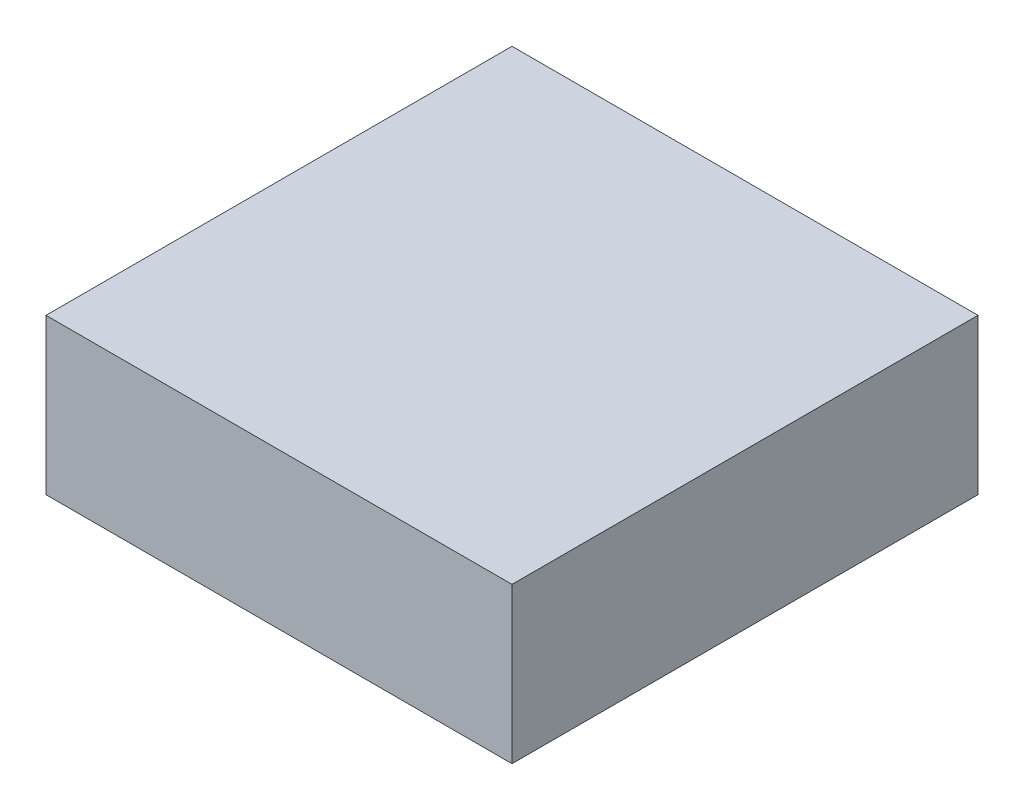
from build123d import *

# Parameters (mm, degrees)
SKETCH_1_W      = 30
SKETCH_1_H      = 30
EXTRUDE_1_DEPTH = 10


with BuildPart() as part:
    # 草图1 → 凸台-拉伸1 (new body)
    with BuildSketch(Plane(origin=(0, 0, 0), x_dir=(1, 0, 0), z_dir=(0, 1, 0))):
        Rectangle(SKETCH_1_W, SKETCH_1_H)
    extrude(amount=EXTRUDE_1_DEPTH)


solid = part.part
